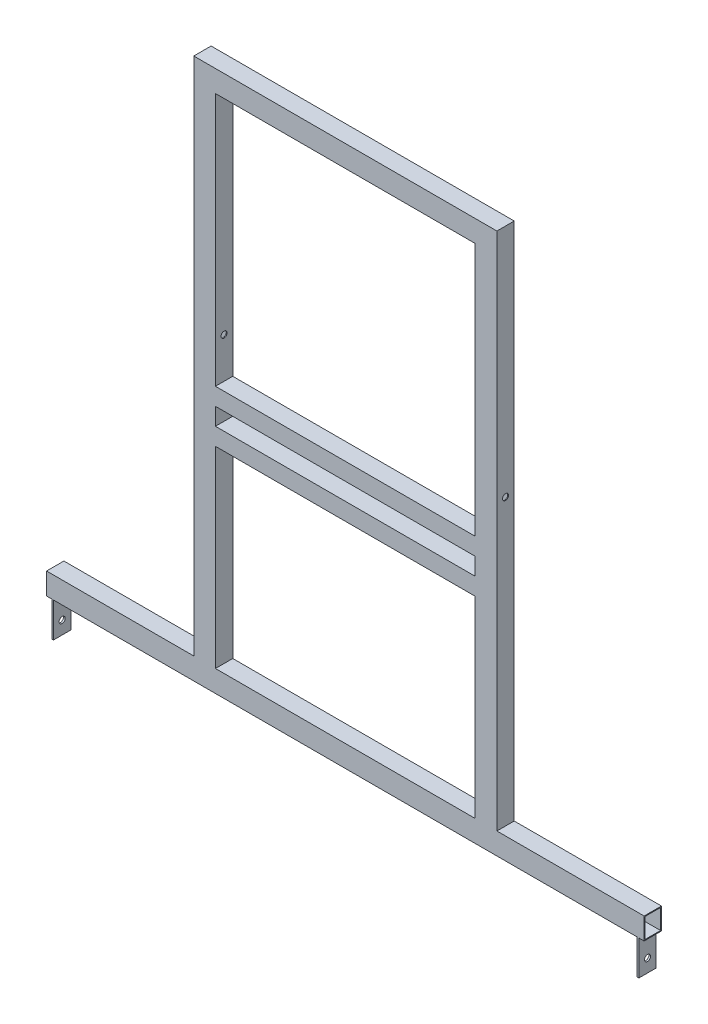
from build123d import *

# Parameters (mm, degrees)
SKETCH2_W               = 300
SKETCH2_H               = 292.795139568
SKETCH2_H_2             = 222.204860432
SKETCH2_H_3             = 20
BOSS_EXTRUDE1_DEPTH     = 20
SHELL1_T                = -1
SKETCH3_W               = 2
SKETCH3_H               = 20
BOSS_EXTRUDE2_DEPTH     = 40
CUT_EXTRUDE1_DEPTH      = 960.966652524
CUT_EXTRUDE1_DEPTH_BACK = 960.966652524
SKETCH4_R               = 3.5
CUT_EXTRUDE2_DEPTH      = 847.070903624
CUT_EXTRUDE2_DEPTH_BACK = 847.070903624
SKETCH5_R               = 3.5


with BuildPart() as part:
    # Sketch2 → Boss-Extrude1 (new body)
    with BuildSketch(Plane.XY):
        Polygon((-19.075846715, -602.110166283), (-189.075846715, -602.110166283), (-189.075846715, -627.110166283), (500.924153285, -627.110166283), (500.924153285, -602.110166283), (330.924153285, -602.110166283), (330.924153285, -2.110166283), (-19.075846715, -2.110166283), align=None)
        with Locations((155.924153285, -173.507736067)):
            Rectangle(SKETCH2_W, SKETCH2_H, mode=Mode.SUBTRACT)
        with Locations((155.924153285, -491.007736067)):
            Rectangle(SKETCH2_W, SKETCH2_H_2, mode=Mode.SUBTRACT)
        with Locations((155.924153285, -349.905305851)):
            Rectangle(SKETCH2_W, SKETCH2_H_3, mode=Mode.SUBTRACT)
    extrude(amount=BOSS_EXTRUDE1_DEPTH)

    # Shell1
    shell1_openings = [part.faces().sort_by_distance(p)[0] for p in [
        (500.924153285, -614.610166283, 10),
        (-189.075846715, -614.610166283, 10),
    ]]
    offset(amount=SHELL1_T, openings=shell1_openings, kind=Kind.INTERSECTION)

    # Sketch3 → Boss-Extrude2 (add)
    with BuildSketch(Plane.XZ.offset(627.110166283)):
        with Locations((493.924153285, 10)):
            Rectangle(SKETCH3_W, SKETCH3_H)
        with Locations((-182.075846715, 10)):
            Rectangle(SKETCH3_W, SKETCH3_H)
    extrude(amount=BOSS_EXTRUDE2_DEPTH)

    # Sketch4 → Cut-Extrude1 (cut, two sides: drawn at the far end of the back side and taken through both)
    with BuildSketch(Plane.ZY.offset(189.075846715).offset(-CUT_EXTRUDE1_DEPTH_BACK)):
        with Locations((10, -652.110166283)):
            Circle(SKETCH4_R)
    extrude(amount=CUT_EXTRUDE1_DEPTH + CUT_EXTRUDE1_DEPTH_BACK, mode=Mode.SUBTRACT)

    # Sketch5 → Cut-Extrude2 (cut, two sides: drawn at the far end of the back side and taken through both)
    with BuildSketch(Plane.ZY.offset(19.075846715).offset(-CUT_EXTRUDE2_DEPTH_BACK)):
        with Locations(Location((10, -273.200166283, 0), (0, 0, 270))):
            Circle(SKETCH5_R)
    extrude(amount=CUT_EXTRUDE2_DEPTH + CUT_EXTRUDE2_DEPTH_BACK, mode=Mode.SUBTRACT)


solid = part.part
